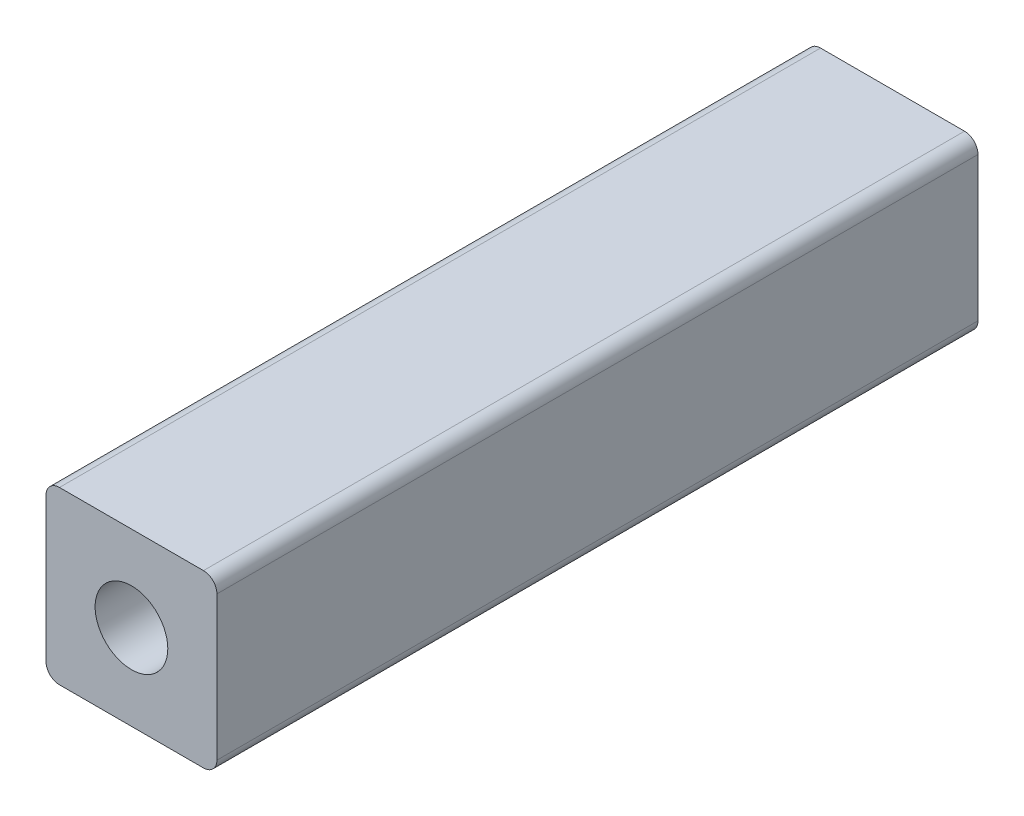
from build123d import *

# Parameters (mm, degrees)
SKETCH1_W           = 12.7
SKETCH1_H           = 12.7
SKETCH1_R           = 2.7
BOSS_EXTRUDE1_DEPTH = 28.275
FILLET2_R           = 1


with BuildPart() as part:
    # Sketch1 → Boss-Extrude1 (new, symmetric)
    with BuildSketch(Plane.XY):
        Rectangle(SKETCH1_W, SKETCH1_H)
        Circle(SKETCH1_R, mode=Mode.SUBTRACT)
    extrude(amount=BOSS_EXTRUDE1_DEPTH, both=True)

    # Fillet2
    fillet2_edges = [part.edges().sort_by_distance(p)[0] for p in [
        (6.35, -6.35, 0),
        (-6.35, -6.35, 0),
        (-6.35, 6.35, 0),
        (6.35, 6.35, 0),
    ]]
    fillet(fillet2_edges, radius=FILLET2_R)


solid = part.part
